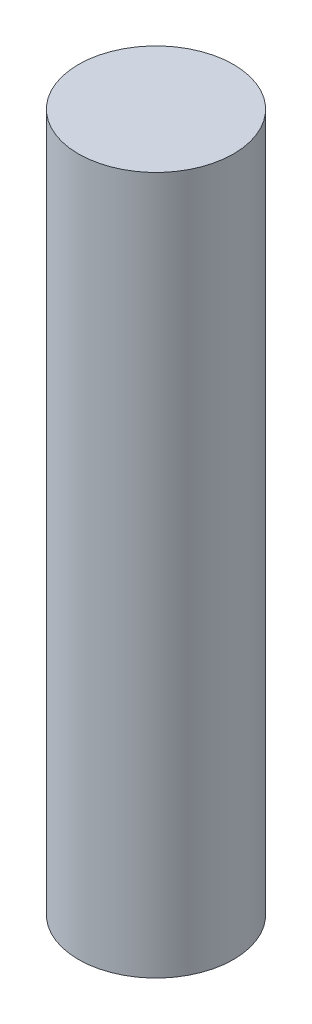
from build123d import *

# Parameters (mm, degrees)
SKETCH1_R           = 1
BOSS_EXTRUDE1_DEPTH = 4.5


with BuildPart() as part:
    # Sketch1 → Boss-Extrude1 (new, symmetric)
    with BuildSketch(Plane(origin=(0, 0, 0), x_dir=(1, 0, 0), z_dir=(0, 1, 0))):
        with Locations(Location((0, 0, 0), (0, 0, 270))):
            Circle(SKETCH1_R)
    extrude(amount=BOSS_EXTRUDE1_DEPTH, both=True)


solid = part.part
